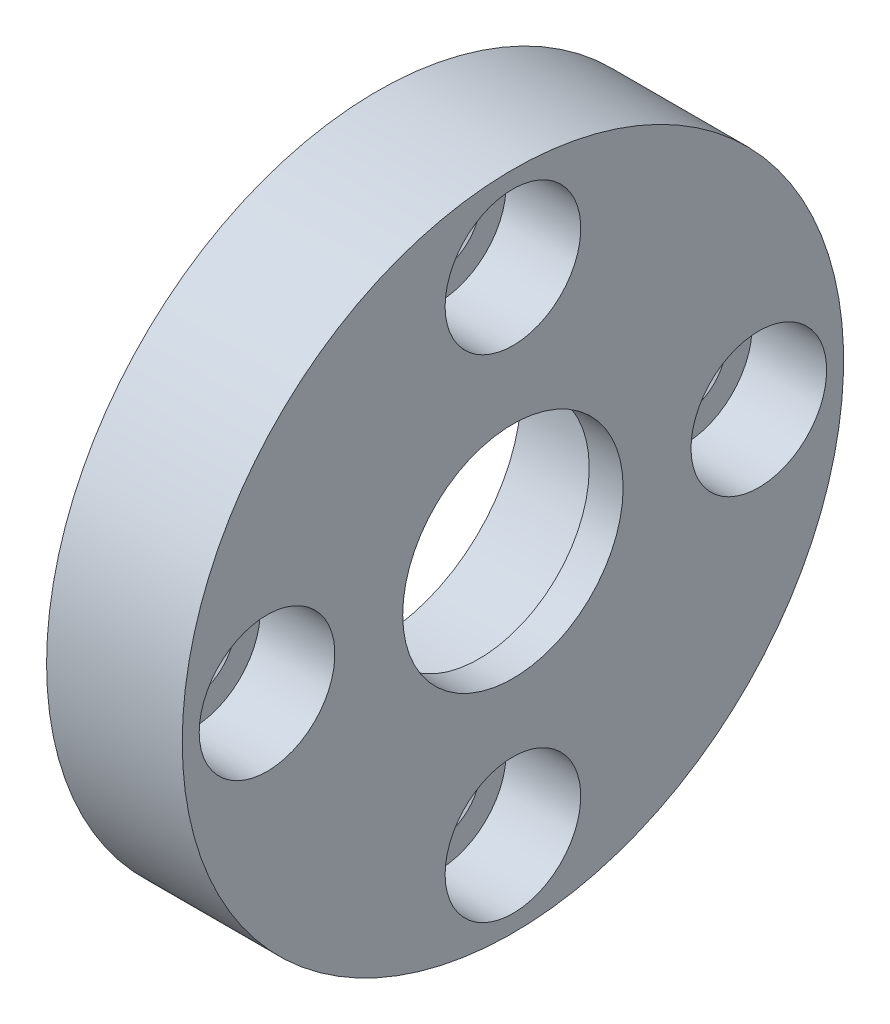
from build123d import *

# Parameters (mm, degrees)
SKETCH_1_W = 8
SKETCH_1_H = 19.5


with BuildPart() as part:
    # ｽｹｯﾁ1 → 回転1 (revolve)
    with BuildSketch(Plane.XY, mode=Mode.PRIVATE) as revolve_1_sk:
        with Locations((0, 9.75)):
            Rectangle(SKETCH_1_W, SKETCH_1_H)
    revolve(revolve_1_sk.sketch.rotate(Axis((4, 0, 0), (-1, 0, 0)), 270), axis=Axis((4, 0, 0), (-1, 0, 0)))

    # ｽｹｯﾁ2 → ｶｯﾄ - 回転1 (revolve, cut)
    with BuildSketch(Plane.XY, mode=Mode.PRIVATE) as cut_revolve_1_sk:
        Polygon((-4, 0), (-4, 8.5), (2, 8.5), (2, 6.5), (4, 6.5), (4, 0), align=None)
    revolve(cut_revolve_1_sk.sketch.rotate(Axis((4, 0, 0), (-1, 0, 0)), 270), axis=Axis((4, 0, 0), (-1, 0, 0)), mode=Mode.SUBTRACT)

    # ｽｹｯﾁ3 → ｶｯﾄ - 回転2 (revolve, cut)
    with BuildSketch(Plane.XY, mode=Mode.PRIVATE) as cut_revolve_2_sk:
        Polygon((-4, 14.5), (-4, 17), (-3.567, 16.567), (-0.833, 16.567), (-0.4, 17), (-0.4, 18.5), (4, 18.5), (4, 14.5), align=None)
    revolve(cut_revolve_2_sk.sketch.rotate(Axis((4, 14.5, 0), (-1, 0, 0)), 270), axis=Axis((4, 14.5, 0), (-1, 0, 0)), mode=Mode.SUBTRACT)

    # ｽｹｯﾁ4 → ｶｯﾄ - 回転3 (revolve, cut)
    with BuildSketch(Plane.XY.offset(14.5), mode=Mode.PRIVATE) as cut_revolve_3_sk:
        Polygon((-4, 0), (-4, 2.5), (-3.567, 2.067), (-0.833, 2.067), (-0.4, 2.5), (-0.4, 4), (4, 4), (4, 0), align=None)
    revolve(cut_revolve_3_sk.sketch.rotate(Axis((4, 0, 14.5), (-1, 0, 0)), 270), axis=Axis((4, 0, 14.5), (-1, 0, 0)), mode=Mode.SUBTRACT)

    # ｽｹｯﾁ5 → ｶｯﾄ - 回転4 (revolve, cut)
    with BuildSketch(Plane.XY, mode=Mode.PRIVATE) as cut_revolve_4_sk:
        Polygon((-4, -14.5), (-4, -12), (-3.567, -12.433), (-0.833, -12.433), (-0.4, -12), (-0.4, -10.5), (4, -10.5), (4, -14.5), align=None)
    revolve(cut_revolve_4_sk.sketch.rotate(Axis((4, -14.5, 0), (-1, 0, 0)), 270), axis=Axis((4, -14.5, 0), (-1, 0, 0)), mode=Mode.SUBTRACT)

    # ｽｹｯﾁ6 → ｶｯﾄ - 回転5 (revolve, cut)
    with BuildSketch(Plane.XY.offset(-14.5), mode=Mode.PRIVATE) as cut_revolve_5_sk:
        Polygon((-4, 0), (-4, 2.5), (-3.567, 2.067), (-0.833, 2.067), (-0.4, 2.5), (-0.4, 4), (4, 4), (4, 0), align=None)
    revolve(cut_revolve_5_sk.sketch.rotate(Axis((4, 0, -14.5), (-1, 0, 0)), 270), axis=Axis((4, 0, -14.5), (-1, 0, 0)), mode=Mode.SUBTRACT)


solid = part.part
